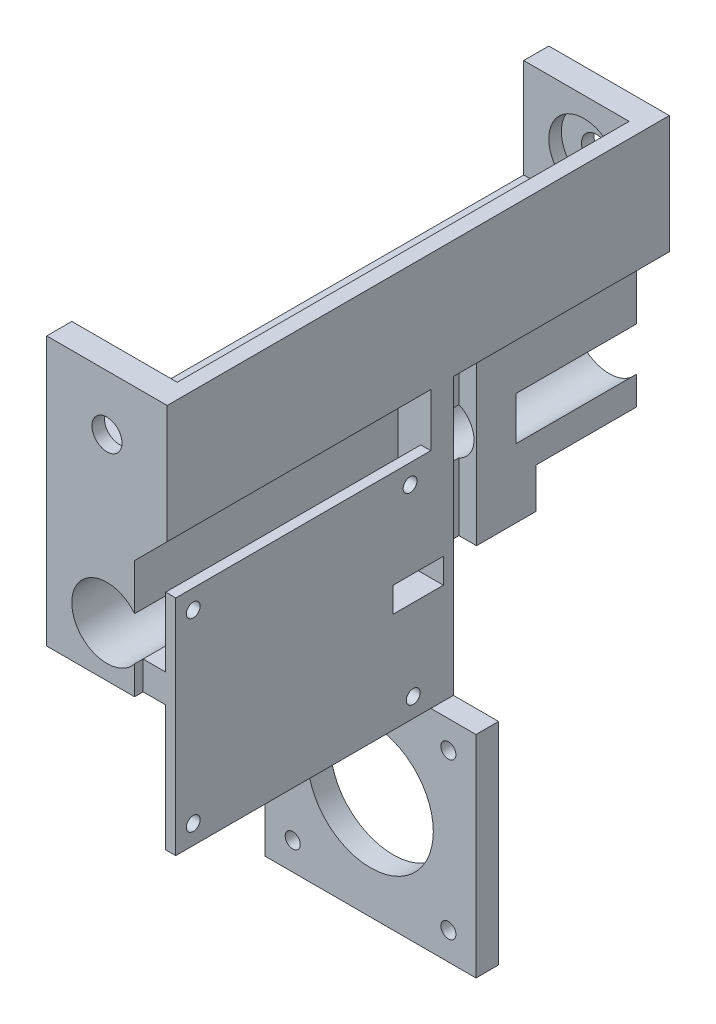
from build123d import *

# Parameters (mm, degrees)
SKETCH1_R               = 7
BOSS_EXTRUDE1_DEPTH     = 50
SKETCH2_R               = 4
CUT_EXTRUDE1_DEPTH      = 17
SKETCH3_W               = 5
SKETCH3_H               = 19.75
BOSS_EXTRUDE2_DEPTH     = 21
SKETCH4_R               = 7
CUT_EXTRUDE4_DEPTH      = 47.5
SKETCH6_R               = 7
SKETCH6_R_2             = 5
BOSS_EXTRUDE3_DEPTH     = 26
CUT_EXTRUDE5_REACH      = 63.576
CUT_EXTRUDE5_END_RADIUS = 7
SKETCH7_R               = 1
CUT_EXTRUDE6_DEPTH      = 102.812634392
CUT_EXTRUDE6_DEPTH_BACK = 102.812634392
SKETCH8_R               = 3
CUT_EXTRUDE7_DEPTH      = 105.209224747
BOSS_EXTRUDE4_DEPTH     = 17.5
CUT_EXTRUDE8_DEPTH      = 78.886134918
SKETCH12_W              = 5
SKETCH12_H              = 11.1
CUT_EXTRUDE9_DEPTH      = 67.234904034
BOSS_EXTRUDE5_REACH     = 82.164
SKETCH13_W              = 6.5
SKETCH13_H              = 4.5
SKETCH14_W              = 2.5
SKETCH14_H              = 5
CUT_EXTRUDE10_DEPTH     = 64.354656605
SKETCH16_R              = 12.5
SKETCH16_R_2            = 1.5
BOSS_EXTRUDE8_DEPTH     = 4.5
SKETCH18_R              = 1.375
BOSS_EXTRUDE9_DEPTH     = 2
BOSS_EXTRUDE10_REACH    = 112.68


with BuildPart() as part:
    # Sketch1 → Boss-Extrude1 (new, symmetric)
    with BuildSketch(Plane.XY):
        Polygon((-12, 7), (9, 7), (9, 26.75), (12, 26.75), (12, -26.75), (-12, -26.75), align=None)
        with Locations((0, -16.75)):
            Circle(SKETCH1_R, mode=Mode.SUBTRACT)
    extrude(amount=BOSS_EXTRUDE1_DEPTH, both=True)

    # Sketch2 → Cut-Extrude1 (cut)
    with BuildSketch(Plane.ZY.offset(12)):
        with Locations((-24.1, -0.75)):
            Circle(SKETCH2_R)
        with Locations((24.1, -0.75)):
            Circle(SKETCH2_R)
    extrude(amount=-CUT_EXTRUDE1_DEPTH, mode=Mode.SUBTRACT)

    # Sketch3 → Boss-Extrude2 (add, through all)
    with BuildSketch(Plane.ZY.offset(-9)):
        with Locations((-47.5, 16.875)):
            Rectangle(SKETCH3_W, SKETCH3_H)
        with Locations((47.5, 16.875)):
            Rectangle(SKETCH3_W, SKETCH3_H)
    extrude(amount=BOSS_EXTRUDE2_DEPTH)

    # Sketch4 → Cut-Extrude4 (cut, symmetric)
    with BuildSketch(Plane.XY):
        with Locations((0, 15.75)):
            Circle(SKETCH4_R)
    extrude(amount=CUT_EXTRUDE4_DEPTH, both=True, mode=Mode.SUBTRACT)

    # Sketch6 → Boss-Extrude3 (add, symmetric)
    with BuildSketch(Plane.XY):
        with Locations((0, -16.75)):
            Circle(SKETCH6_R)
        with Locations(Location((0, -16.75, 0), (0, 0, 180))):
            Circle(SKETCH6_R_2, mode=Mode.SUBTRACT)
    extrude(amount=BOSS_EXTRUDE3_DEPTH, both=True)

    # Cut-Extrude5: up to this cylinder (the profile starts outside it)
    cut_extrude5_end = Plane(origin=(0, -16.75, 0), z_dir=(0, 0, -1)) * Cylinder(CUT_EXTRUDE5_END_RADIUS, 212.152, mode=Mode.PRIVATE)
    # Sketch7 → Cut-Extrude5 (cut, up to the surface)
    with BuildSketch(Plane.ZY.offset(12), mode=Mode.PRIVATE) as cut_extrude5_sk1:
        with Locations((-35, -16.75)):
            Circle(SKETCH7_R)
    cut_extrude5_tool1 = extrude(cut_extrude5_sk1.sketch, amount=-CUT_EXTRUDE5_REACH, mode=Mode.PRIVATE) - cut_extrude5_end
    add(cut_extrude5_tool1.solids().sort_by_distance((-12, -16.75, -35))[0], mode=Mode.SUBTRACT)
    # Sketch7 → Cut-Extrude5 (cut, up to the surface)
    with BuildSketch(Plane.ZY.offset(12), mode=Mode.PRIVATE) as cut_extrude5_sk2:
        with Locations((35, -16.75)):
            Circle(SKETCH7_R)
    cut_extrude5_tool2 = extrude(cut_extrude5_sk2.sketch, amount=-CUT_EXTRUDE5_REACH, mode=Mode.PRIVATE) - cut_extrude5_end
    add(cut_extrude5_tool2.solids().sort_by_distance((-12, -16.75, 35))[0], mode=Mode.SUBTRACT)

    # Sketch8 → Cut-Extrude6 (cut, two sides: drawn at the far end of the back side and taken through both)
    with BuildSketch(Plane(origin=(0, 0, 47.5), x_dir=(-1, 0, 0), z_dir=(0, 0, -1)).offset(-CUT_EXTRUDE6_DEPTH_BACK)):
        with Locations((0, 15.75)):
            Circle(SKETCH8_R)
    extrude(amount=CUT_EXTRUDE6_DEPTH + CUT_EXTRUDE6_DEPTH_BACK, mode=Mode.SUBTRACT)

    # Sketch9 → Cut-Extrude7 (cut, through all)
    with BuildSketch(Plane.XY.offset(50)):
        Polygon((5.5, -3.25), (12, 3.25), (12, -26.75), (5.5, -26.75), align=None)
    extrude(amount=-CUT_EXTRUDE7_DEPTH, mode=Mode.SUBTRACT)

    # Sketch10 → Boss-Extrude4 (add)
    with BuildSketch(Plane.ZY.offset(12)):
        Polygon((-5, -26.75), (-5, -31.75), (5, -31.75), (5, -26.75), (30, -26.75), (30, -34.75), (-30, -34.75), (-30, -26.75), align=None)
    extrude(amount=-BOSS_EXTRUDE4_DEPTH)

    # Sketch11 → Cut-Extrude8 (cut, through all)
    with BuildSketch(Plane(origin=(0, -31.75, 0), x_dir=(1, 0, 0), z_dir=(0, 1, 0))):
        with BuildLine():
            Line((0, 2.5), (-12, 2.5))
            Line((-12, 2.5), (-12, -2.5))
            Line((-12, -2.5), (0, -2.5))
            ThreePointArc((0, -2.5), (2.5, 0), (0, 2.5))
        make_face()
    extrude(amount=-CUT_EXTRUDE8_DEPTH, mode=Mode.SUBTRACT)

    # Sketch12 → Cut-Extrude9 (cut, through all)
    with BuildSketch(Plane(origin=(0, 7, 0), x_dir=(1, 0, 0), z_dir=(0, 1, 0))):
        with Locations((4.5, 12.55)):
            Rectangle(SKETCH12_W, SKETCH12_H)
        with Locations((-4.5, 12.55)):
            Rectangle(SKETCH12_W, SKETCH12_H)
    extrude(amount=-CUT_EXTRUDE9_DEPTH, mode=Mode.SUBTRACT)

    # Sketch13 → Boss-Extrude5 (add, up to next)
    with BuildSketch(Plane.XZ.offset(34.75), mode=Mode.PRIVATE) as boss_extrude5_sk1:
        with Locations((8.75, -4.75)):
            Rectangle(SKETCH13_W, SKETCH13_H)
    boss_extrude5_tool1 = extrude(boss_extrude5_sk1.sketch, amount=-BOSS_EXTRUDE5_REACH, mode=Mode.PRIVATE) - part.part
    add(boss_extrude5_tool1.solids().sort_by_distance((8.75, -34.75, -4.75))[0])

    # Sketch14 → Cut-Extrude10 (cut, through all)
    with BuildSketch(Plane.ZY.offset(-5.5)):
        with Locations((-3.75, -29.25)):
            Rectangle(SKETCH14_W, SKETCH14_H)
    extrude(amount=-CUT_EXTRUDE10_DEPTH, mode=Mode.SUBTRACT)

    # Sketch16 → Boss-Extrude8 (add)
    with BuildSketch(Plane(origin=(0, 0, -7), x_dir=(-1, 0, 0), z_dir=(0, 0, -1))):
        Polygon((-12, -34.75), (-5, -34.75), (-5, -49.75), (5, -49.75), (5, -34.75), (12, -34.75), (12, -51.75), (21, -51.75), (21, -93.75), (-21, -93.75), (-21, -51.75), (-12, -51.75), align=None)
        with Locations((0, -72.75)):
            Circle(SKETCH16_R, mode=Mode.SUBTRACT)
        with Locations((-15.5, -57.25)):
            Circle(SKETCH16_R_2, mode=Mode.SUBTRACT)
        with Locations((15.5, -57.25)):
            Circle(SKETCH16_R_2, mode=Mode.SUBTRACT)
        with Locations((15.5, -88.25)):
            Circle(SKETCH16_R_2, mode=Mode.SUBTRACT)
        with Locations((-15.5, -88.25)):
            Circle(SKETCH16_R_2, mode=Mode.SUBTRACT)
    extrude(amount=-BOSS_EXTRUDE8_DEPTH)

    # Sketch18 → Boss-Extrude9 (add)
    with BuildSketch(Plane(origin=(12, 0, 0), x_dir=(0, 0, -1), z_dir=(1, 0, 0))):
        Polygon((2.5, -51.75), (-48.3, -51.75), (-48.3, -7.3), (2.5, -7.3), (2.5, -26.75), (-5, -26.75), (-5, -31.75), (2.5, -31.75), align=None)
        with Locations((-44.81, -11.11)):
            Circle(SKETCH18_R, mode=Mode.SUBTRACT)
        with Locations((-0.99, -47.94)):
            Circle(SKETCH18_R, mode=Mode.SUBTRACT)
        with Locations((-44.81, -47.94)):
            Circle(SKETCH18_R, mode=Mode.SUBTRACT)
        with Locations((-1.63, -11.11)):
            Circle(SKETCH18_R, mode=Mode.SUBTRACT)
    extrude(amount=-BOSS_EXTRUDE9_DEPTH)

    # Sketch20 → Boss-Extrude10 (add, up to next)
    with BuildSketch(Plane.ZY.offset(-10), mode=Mode.PRIVATE) as boss_extrude10_sk1:
        Polygon((-2.5, -31.75), (-2.5, -34.75), (30, -34.75), (30, -26.75), (48.3, -26.75), (48.3, -21.080127019), (-2.5, -21.080127019), (-2.5, -26.75), (5, -26.75), (5, -31.75), align=None)
    boss_extrude10_tool1 = extrude(boss_extrude10_sk1.sketch, amount=BOSS_EXTRUDE10_REACH, mode=Mode.PRIVATE) - part.part
    add(boss_extrude10_tool1.solids().sort_by_distance((10, -27.004059, 19.830393))[0])


solid = part.part
